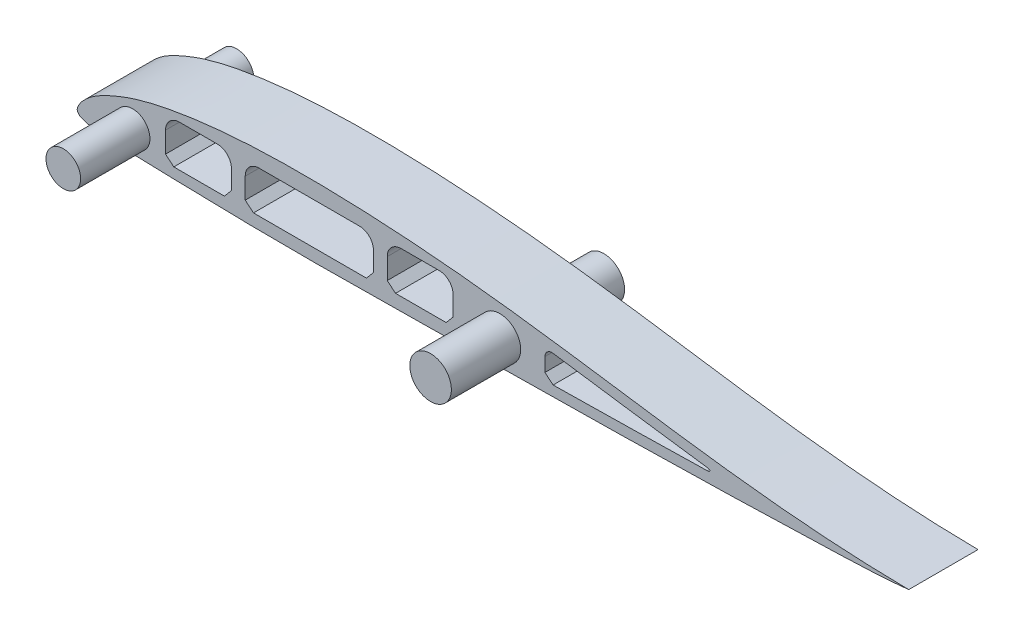
from build123d import *
from OCP.BRepFilletAPI import BRepFilletAPI_MakeChamfer

# Parameters (mm, degrees)
BOSS_EXTRUDE2_DEPTH = 10
SKETCH7_W           = 9.5
SKETCH7_H           = 6
CUT_EXTRUDE1_DEPTH  = 10
SKETCH8_R           = 2.5
SKETCH8_R_2         = 3
BOSS_EXTRUDE3_DEPTH = 5
CUT_EXTRUDE2_DEPTH  = 122.21073053
FILLET3_R           = 1
SKETCH13_W          = 18.5
SKETCH13_H          = 6
CUT_EXTRUDE5_DEPTH  = 122.21073053
FILLET6_R           = 2
CHAMFER1_SIZE       = 1
CHAMFER1_SIZE2      = 1.191753593
CHAMFER1_SIZE2_2    = 1.171807553
SKETCH16_R          = 2.5
SKETCH16_R_2        = 3
BOSS_EXTRUDE4_DEPTH = 5


with BuildPart() as part:
    # Sketch6 → Boss-Extrude2 (new body)
    with BuildSketch(Plane.XY):
        with BuildLine():
            add(Edge.make_bspline(
                [(0, 0), (-0.008611513, -0.127430511), (0.221644246, -0.563649065), (1.094362282, -0.91532513), (1.842710123, -1.146259201), (4.71177567, -1.408313129), (6.107216535, -1.505722547), (18.678398238, -1.839821435), (29.581366926, -2.110055049), (59.404326862, -1.708687455), (84.791069622, -1.423809846), (105.582925761, -0.758055626), (113.619439095, -0.483430704), (117.04363686, -0.312290514), (120, 0)],
                knots=[0, 0, 0, 0, 0.004810779, 0.006936594, 0.019666867, 0.026079257, 0.064648101, 0.089687284, 0.271649986, 0.404755653, 0.802070019, 0.908773576, 0.928566574, 1, 1, 1, 1], degree=3))
            add(Edge.make_bspline(
                [(0.086608489, 0.35854001), (0.216879409, 0.675687027), (0.469463756, 1.106948829), (1.507040169, 2.266368576), (2.829321195, 3.185238239), (6.430595838, 4.92530321), (9.75435703, 5.993144427), (20.175146563, 8.017210096), (37.130188875, 8.560501642), (72.506612326, 5.792697629), (97.728296338, 0.238661864), (120, 0)],
                knots=[0, 0, 0, 0, 0.006718919, 0.010620863, 0.035864043, 0.046850537, 0.109499311, 0.137094959, 0.314975923, 0.510864852, 1, 1, 1, 1], degree=3))
            add(Edge.make_bspline(
                [(0.086608489, 0.35854001), (0.053888696, 0.278883055), (0.006859116, 0.101499078), (0, 0)],
                knots=[0, 0, 0, 0, 1, 1, 1, 1], degree=3))
        make_face()
    extrude(amount=BOSS_EXTRUDE2_DEPTH)

    # Sketch7 → Cut-Extrude1 (cut)
    with BuildSketch(Plane.XY.offset(10)):
        with Locations((17.5, 2.8)):
            Rectangle(SKETCH7_W, SKETCH7_H)
        with Locations((49.5, 3)):
            Rectangle(SKETCH7_W, SKETCH7_H)
    extrude(amount=-CUT_EXTRUDE1_DEPTH, mode=Mode.SUBTRACT)

    # Sketch8 → Boss-Extrude3 (add)
    with BuildSketch(Plane.XY.offset(10)):
        with Locations(Location((8, 1.6, 0), (0, 0, 180))):
            Circle(SKETCH8_R)
        with Locations(Location((61, 2, 0), (0, 0, 180))):
            Circle(SKETCH8_R_2)
    boss_extrude3 = extrude(amount=BOSS_EXTRUDE3_DEPTH)

    # Mirror1: Boss-Extrude3 across plane
    add(boss_extrude3.mirror(Plane.XY.offset(5)))

    # Sketch9 → Cut-Extrude2 (cut, through all)
    with BuildSketch(Plane.XY.offset(10)):
        with BuildLine():
            Line((67.506544747, 4.027851827), (67.506544747, -0.107872593))
            add(Edge.make_bspline(
                [(67.506544747, -0.107872593), (75.060194953, 0.000680431), (82.613565532, 0.128496667), (90.42126388, 0.313196487), (90.67666969, 0.31930677), (90.932073832, 0.325484308)],
                knots=[0.066454025, 0.066454025, 0.066454025, 0.066454025, 0.089117236, 0.089117236, 0.089883673, 0.089883673, 0.089883673, 0.089883673], degree=3))
            add(Edge.make_bspline(
                [(90.932073832, 0.715704315), (91.178893489, 0.683770337), (91.456081268, 0.554365648), (91.206734776, 0.332127617), (90.932073832, 0.325484308)],
                knots=[0, 0, 0, 0, 0.493467763, 1, 1, 1, 1], degree=3))
            add(Edge.make_bspline(
                [(67.506544747, 4.027851827), (74.397511821, 3.092112705), (81.214476598, 2.023534767), (89.124379402, 0.952595725), (90.026361168, 0.832887073), (90.932073832, 0.715704315)],
                knots=[0.573826269, 0.573826269, 0.573826269, 0.573826269, 0.75, 0.75, 0.772584785, 0.772584785, 0.772584785, 0.772584785], degree=3))
        make_face()
    extrude(amount=-CUT_EXTRUDE2_DEPTH, mode=Mode.SUBTRACT)

    # Fillet3
    fillet3_edges = [part.edges().sort_by_distance(p)[0] for p in [
        (67.506544747, 4.027851827, 5),
    ]]
    fillet(fillet3_edges, radius=FILLET3_R)

    # Sketch13 → Cut-Extrude5 (cut, through all)
    with BuildSketch(Plane.XY.offset(10)):
        with Locations((33.5, 2.8)):
            Rectangle(SKETCH13_W, SKETCH13_H)
    extrude(amount=-CUT_EXTRUDE5_DEPTH, mode=Mode.SUBTRACT)

    # Fillet6
    fillet6_edges = [part.edges().sort_by_distance(p)[0] for p in [
        (24.25, 5.8, 5),
        (42.75, 5.8, 5),
        (12.75, 5.8, 5),
        (22.25, 5.8, 5),
        (44.75, 6, 5),
        (54.25, 6, 5),
    ]]
    fillet(fillet6_edges, radius=FILLET6_R)

    # Chamfer1: one chamfer whose edges measure the first distance from different faces: ONE call of the kernel's chamfer builder (chamfer() names one face for all edges)
    chamfer1_edges_1 = [part.edges().sort_by_distance(p)[0] for p in [
        (12.75, -0.2, 5),
    ]]
    chamfer1_side_1 = [part.faces().sort_by_distance(p)[0] for p in [
        (12.75, 1.8, 5),
    ]]
    chamfer1_edges_2 = [part.edges().sort_by_distance(p)[0] for p in [
        (22.25, -0.2, 5),
    ]]
    chamfer1_side_2 = [part.faces().sort_by_distance(p)[0] for p in [
        (17.5, -0.2, 5),
    ]]
    chamfer1_edges_3 = [part.edges().sort_by_distance(p)[0] for p in [
        (54.25, 0, 5),
    ]]
    chamfer1_side_3 = [part.faces().sort_by_distance(p)[0] for p in [
        (49.5, 0, 5),
    ]]
    chamfer1_edges_4 = [part.edges().sort_by_distance(p)[0] for p in [
        (44.75, 0, 5),
    ]]
    chamfer1_side_4 = [part.faces().sort_by_distance(p)[0] for p in [
        (44.75, 2, 5),
    ]]
    chamfer1_edges_5 = [part.edges().sort_by_distance(p)[0] for p in [
        (67.506544747, -0.107872593, 5),
    ]]
    chamfer1_side_5 = [part.faces().sort_by_distance(p)[0] for p in [
        (67.506544747, 1.386881222, 5),
    ]]
    chamfer1_edges_6 = [part.edges().sort_by_distance(p)[0] for p in [
        (42.75, -0.2, 5),
    ]]
    chamfer1_side_6 = [part.faces().sort_by_distance(p)[0] for p in [
        (33.5, -0.2, 5),
    ]]
    chamfer1_edges_7 = [part.edges().sort_by_distance(p)[0] for p in [
        (24.25, -0.2, 5),
    ]]
    chamfer1_side_7 = [part.faces().sort_by_distance(p)[0] for p in [
        (24.25, 1.8, 5),
    ]]
    chamfer1 = BRepFilletAPI_MakeChamfer(part.part.solid().wrapped)
    for e in chamfer1_edges_1:
        chamfer1.Add(CHAMFER1_SIZE, CHAMFER1_SIZE2, e.wrapped, chamfer1_side_1[0].wrapped)  # the first distance lies on this face
    for e in chamfer1_edges_2:
        chamfer1.Add(CHAMFER1_SIZE, CHAMFER1_SIZE2, e.wrapped, chamfer1_side_2[0].wrapped)  # the first distance lies on this face
    for e in chamfer1_edges_3:
        chamfer1.Add(CHAMFER1_SIZE, CHAMFER1_SIZE2, e.wrapped, chamfer1_side_3[0].wrapped)  # the first distance lies on this face
    for e in chamfer1_edges_4:
        chamfer1.Add(CHAMFER1_SIZE, CHAMFER1_SIZE2, e.wrapped, chamfer1_side_4[0].wrapped)  # the first distance lies on this face
    for e in chamfer1_edges_5:
        chamfer1.Add(CHAMFER1_SIZE, CHAMFER1_SIZE2_2, e.wrapped, chamfer1_side_5[0].wrapped)  # the first distance lies on this face
    for e in chamfer1_edges_6:
        chamfer1.Add(CHAMFER1_SIZE, CHAMFER1_SIZE2, e.wrapped, chamfer1_side_6[0].wrapped)  # the first distance lies on this face
    for e in chamfer1_edges_7:
        chamfer1.Add(CHAMFER1_SIZE, CHAMFER1_SIZE2, e.wrapped, chamfer1_side_7[0].wrapped)  # the first distance lies on this face
    add(Compound.cast(chamfer1.Shape()), mode=Mode.REPLACE)

    # Sketch16 → Boss-Extrude4 (add)
    with BuildSketch(Plane.XY.offset(15)):
        with Locations(Location((8, 1.6, 0), (0, 0, 180))):
            Circle(SKETCH16_R)
        with Locations(Location((61, 2, 0), (0, 0, 180))):
            Circle(SKETCH16_R_2)
    extrude(amount=BOSS_EXTRUDE4_DEPTH)


solid = part.part
